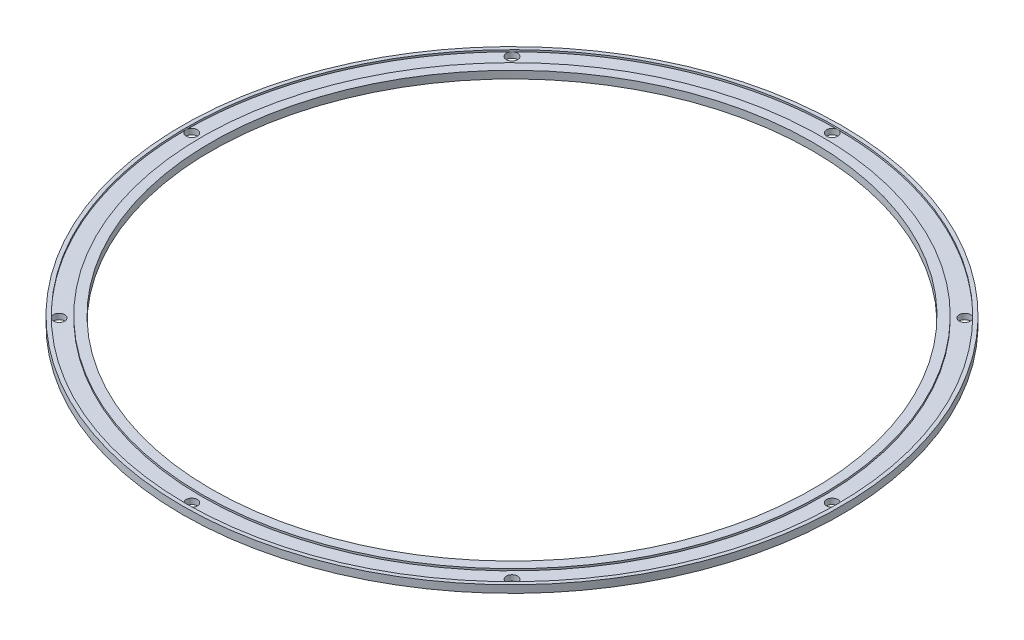
from build123d import *

# Parameters (mm, degrees)
SKETCH_2_R          = 1.5
CUT_EXTRUDE_1_DEPTH = 125.459832878


with BuildPart() as part:
    # 草图1 → 旋转1 (revolve)
    with BuildSketch(Plane.XY, mode=Mode.PRIVATE) as revolve_1_sk:
        Polygon((80.25, 0), (88, 0), (88, 2), (87, 2), (87, 1.5), (82.75, 1.5), (82.75, 2), (80.25, 2), align=None)
    revolve(revolve_1_sk.sketch.rotate(Axis((0, 155.597353718, 0), (0, -1, 0)), 90), axis=Axis((0, 155.597353718, 0), (0, -1, 0)))

    # 草图2 → 切除-拉伸1 (cut, through all)
    with BuildSketch(Plane(origin=(0, 1.5, 0), x_dir=(1, 0, 0), z_dir=(0, 1, 0))):
        with Locations(Location((0, 85.5, 0), (0, 0, 270))):
            Circle(SKETCH_2_R)
        with Locations(Location((60.457629791, 60.457629791, 0), (0, 0, 270))):
            Circle(SKETCH_2_R)
        with Locations(Location((85.5, 0, 0), (0, 0, 270))):
            Circle(SKETCH_2_R)
        with Locations(Location((60.457629791, -60.457629791, 0), (0, 0, 270))):
            Circle(SKETCH_2_R)
        with Locations(Location((0, -85.5, 0), (0, 0, 270))):
            Circle(SKETCH_2_R)
        with Locations(Location((-60.457629791, -60.457629791, 0), (0, 0, 270))):
            Circle(SKETCH_2_R)
        with Locations(Location((-85.5, 0, 0), (0, 0, 270))):
            Circle(SKETCH_2_R)
        with Locations(Location((-60.457629791, 60.457629791, 0), (0, 0, 270))):
            Circle(SKETCH_2_R)
    extrude(amount=-CUT_EXTRUDE_1_DEPTH, mode=Mode.SUBTRACT)


solid = part.part
